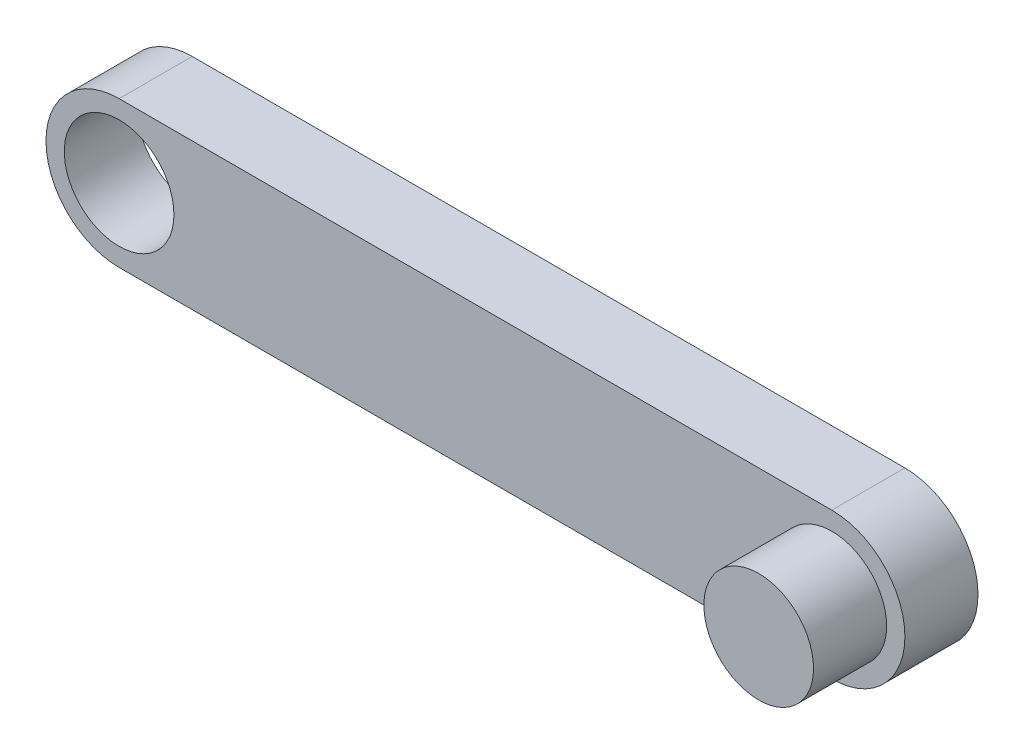
from build123d import *

# Parameters (mm, degrees)
BOSS_EXTRUDE1_DEPTH = 20
SKETCH2_R           = 15
CUT_EXTRUDE1_DEPTH  = 20
SKETCH3_R           = 15
BOSS_EXTRUDE2_DEPTH = 20


with BuildPart() as part:
    # Sketch1 → Boss-Extrude1 (new body)
    with BuildSketch(Plane.XY):
        with BuildLine():
            Line((97.5, 20), (-97.5, 20))
            ThreePointArc((-97.5, 20), (-117.5, 0), (-97.5, -20))
            Line((-97.5, -20), (97.5, -20))
            ThreePointArc((97.5, -20), (117.5, 0), (97.5, 20))
        make_face()
    extrude(amount=BOSS_EXTRUDE1_DEPTH)

    # Sketch2 → Cut-Extrude1 (cut)
    with BuildSketch(Plane.XY.offset(20)):
        with Locations((-97.5, 0)):
            Circle(SKETCH2_R)
    extrude(amount=-CUT_EXTRUDE1_DEPTH, mode=Mode.SUBTRACT)

    # Sketch3 → Boss-Extrude2 (add)
    with BuildSketch(Plane.XY.offset(20)):
        with Locations((97.5, 0)):
            Circle(SKETCH3_R)
    extrude(amount=BOSS_EXTRUDE2_DEPTH)


solid = part.part
